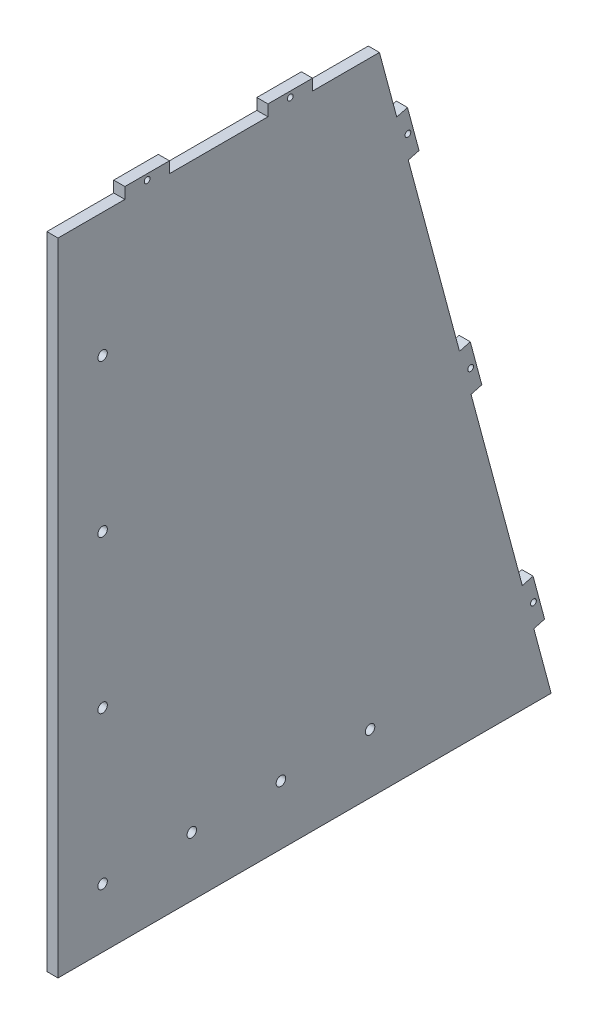
from build123d import *

# Parameters (mm, degrees)
SKETCH1_R           = 1.65
SKETCH1_R_2         = 2.7
BOSS_EXTRUDE1_DEPTH = 6.35


with BuildPart() as part:
    # Sketch1 → Boss-Extrude1 (new body)
    with BuildSketch(Plane(origin=(-388.62, 0, 0), x_dir=(0, -1, 0), z_dir=(-1, 0, 0))):
        Polygon((-371.45, -148.811863322), (-365.1, -148.811863322), (-365.1, -186.911863322), (-328.298226018, -196.772868941), (-329.941726955, -202.906497938), (-305.407210967, -209.480501683), (-303.763710031, -203.346872686), (-194.817257994, -232.538986528), (-196.46075893, -238.672615525), (-171.926242943, -245.24661927), (-170.282742006, -239.112990273), (-61.336289969, -268.305104115), (-62.979790906, -274.438733112), (-38.445274918, -281.012736857), (-36.801773982, -274.87910786), (0, -284.740113479), (0, -3.788281448), (-365.1, -3.788281448), (-365.1, -41.888281448), (-371.45, -41.888281448), (-371.45, -67.288281448), (-365.1, -67.288281448), (-365.1, -123.411863322), (-371.45, -123.411863322), align=None)
        with Locations(Location((-49.890782444, -274.658920486, 0), (0, 0, 90))):
            Circle(SKETCH1_R, mode=Mode.SUBTRACT)
        with Locations(Location((-368.275, -54.588281448, 0), (0, 0, 90))):
            Circle(SKETCH1_R, mode=Mode.SUBTRACT)
        with Locations(Location((-183.371750468, -238.892802899, 0), (0, 0, 90))):
            Circle(SKETCH1_R, mode=Mode.SUBTRACT)
        with Locations(Location((-368.275, -136.111863322, 0), (0, 0, 90))):
            Circle(SKETCH1_R, mode=Mode.SUBTRACT)
        with Locations(Location((-316.852718493, -203.126685312, 0), (0, 0, 90))):
            Circle(SKETCH1_R, mode=Mode.SUBTRACT)
        with Locations(Location((-294.45, -29.188301448, 0), (0, 0, 90))):
            Circle(SKETCH1_R_2, mode=Mode.SUBTRACT)
        with Locations(Location((-207.55, -29.188301448, 0), (0, 0, 90))):
            Circle(SKETCH1_R_2, mode=Mode.SUBTRACT)
        with Locations(Location((-120.65, -29.188301448, 0), (0, 0, 90))):
            Circle(SKETCH1_R_2, mode=Mode.SUBTRACT)
        with Locations(Location((-33.74898, -181.588301448, 0), (0, 0, 90))):
            Circle(SKETCH1_R_2, mode=Mode.SUBTRACT)
        with Locations(Location((-33.74898, -29.188301448, 0), (0, 0, 90))):
            Circle(SKETCH1_R_2, mode=Mode.SUBTRACT)
        with Locations(Location((-33.74898, -130.788301448, 0), (0, 0, 90))):
            Circle(SKETCH1_R_2, mode=Mode.SUBTRACT)
        with Locations(Location((-33.74898, -79.988301448, 0), (0, 0, 90))):
            Circle(SKETCH1_R_2, mode=Mode.SUBTRACT)
    extrude(amount=-BOSS_EXTRUDE1_DEPTH)


solid = part.part
